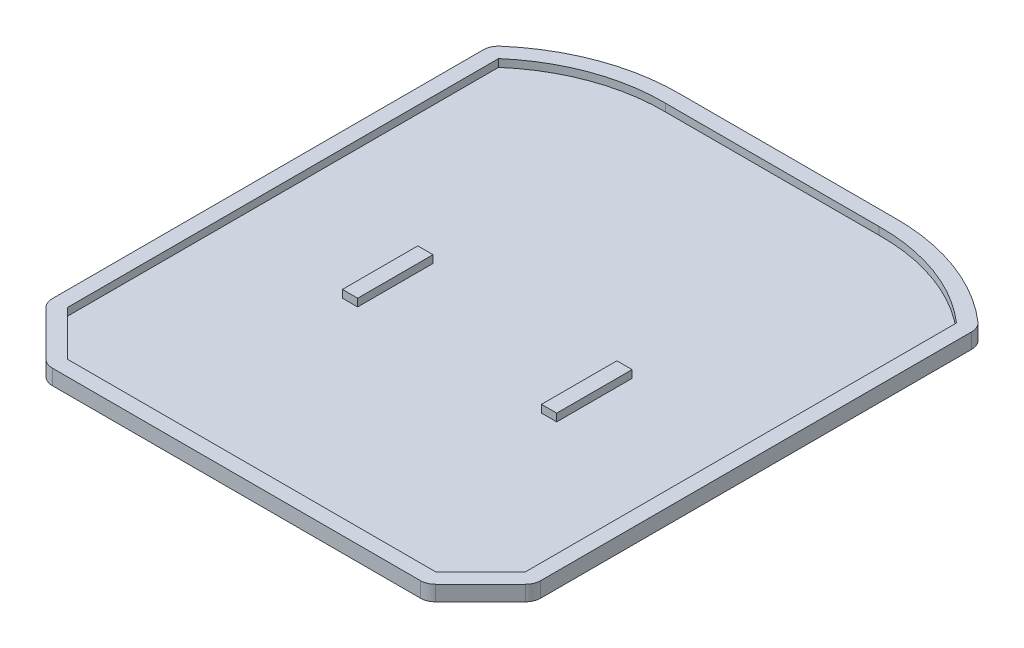
from build123d import *

# Parameters (mm, degrees)
BODY_DEPTH                   = 10
INSIDE_BODY_DEPTH            = 5
SKETCH3_W                    = 10
SKETCH3_H                    = 49.5
HORIZONTAL_CONSTRAINTS_DEPTH = 5
FILLET1_R                    = 10


with BuildPart() as part:
    # Sketch1 → Body (new body)
    with BuildSketch(Plane(origin=(0, 0, 0), x_dir=(1, 0, 0), z_dir=(0, 1, 0))):
        with BuildLine():
            Line((0, 0), (250, 0))
            Line((250, 0), (285.355339059, 35.355339059))
            Line((285.355339059, 35.355339059), (285.355339059, 326.955339059))
            ThreePointArc((285.355339059, 326.955339059), (243.560486982, 353.188356712), (195, 361.955339059))
            Line((195, 361.955339059), (55, 361.955339059))
            ThreePointArc((55, 361.955339059), (6.439513018, 353.188356712), (-35.355339059, 326.955339059))
            Line((-35.355339059, 326.955339059), (-35.355339059, 35.355339059))
            Line((-35.355339059, 35.355339059), (0, 0))
        make_face()
    extrude(amount=BODY_DEPTH)

    # Sketch2 → Inside Body (cut)
    with BuildSketch(Plane(origin=(0, 10, 0), x_dir=(1, 0, 0), z_dir=(0, 1, 0))):
        with BuildLine():
            Line((-25.355339059, 322.508901748), (-25.355339059, 39.497474683))
            Line((-25.355339059, 39.497474683), (4.142135624, 10))
            Line((4.142135624, 10), (245.857864376, 10))
            Line((245.857864376, 10), (275.355339059, 39.497474683))
            Line((275.355339059, 39.497474683), (275.355339059, 322.508901748))
            ThreePointArc((275.355339059, 322.508901748), (237.921386907, 344.627720124), (195.062911656, 351.955339059))
            Line((195.062911656, 351.955339059), (54.937088344, 351.955339059))
            ThreePointArc((54.937088344, 351.955339059), (12.078613093, 344.627720124), (-25.355339059, 322.508901748))
        make_face()
    extrude(amount=-INSIDE_BODY_DEPTH, mode=Mode.SUBTRACT)

    # Sketch3 → Horizontal Constraints (add)
    with BuildSketch(Plane(origin=(0, 5, 0), x_dir=(1, 0, 0), z_dir=(0, 1, 0))):
        with Locations((59.644660941, 164.75)):
            Rectangle(SKETCH3_W, SKETCH3_H)
        with Locations((190.355339059, 164.75)):
            Rectangle(SKETCH3_W, SKETCH3_H)
    extrude(amount=HORIZONTAL_CONSTRAINTS_DEPTH)

    # Fillet1
    fillet1_edges = [part.edges().sort_by_distance(p)[0] for p in [
        (-35.355339059, 5, -326.955339059),
        (285.355339059, 5, -326.955339059),
        (285.355339059, 5, -35.355339059),
        (250, 5, 0),
        (0, 5, 0),
        (-35.355339059, 5, -35.355339059),
    ]]
    fillet(fillet1_edges, radius=FILLET1_R)


solid = part.part
